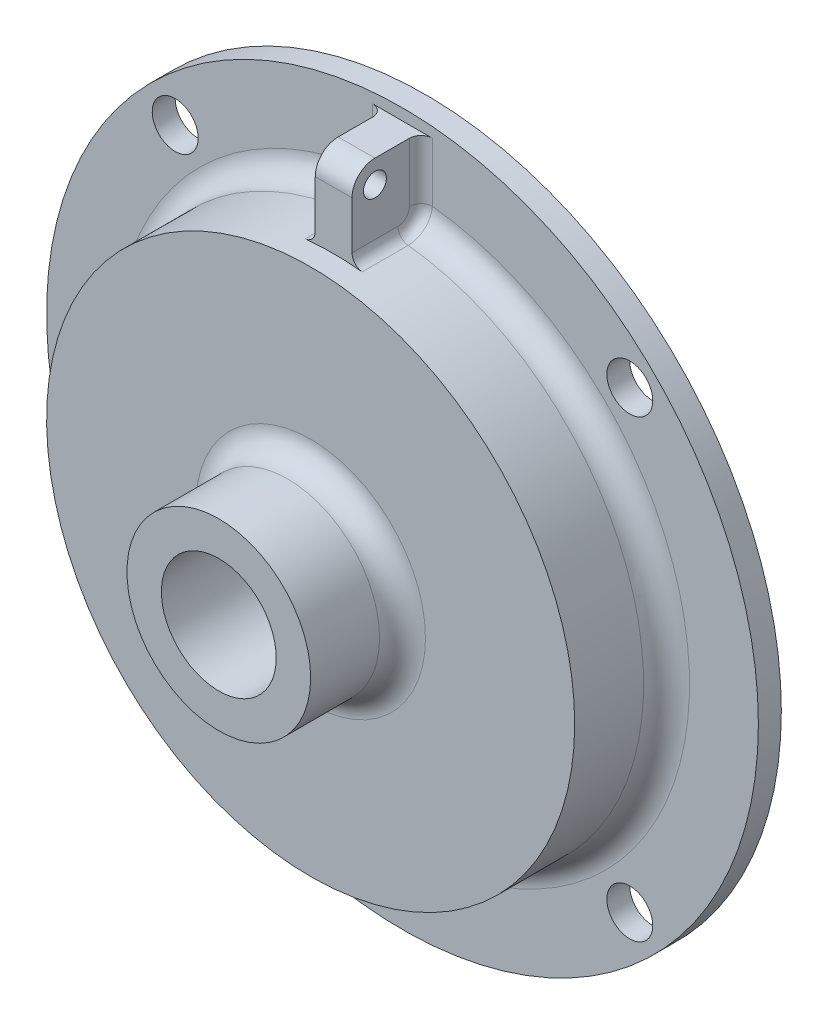
from build123d import *

# Parameters (mm, degrees)
SKETCH1_R           = 49.2125
BASE_EXTRUDE_DEPTH  = 3.175
SKETCH5_R           = 3.175
CUT_EXTRUDE2_DEPTH  = 70.669368718
CIRPATTERN1_COUNT   = 4
SKETCH2_R           = 36.5125
BOSS_EXTRUDE1_DEPTH = 12.7
SKETCH3_R           = 12.7
BOSS_EXTRUDE2_DEPTH = 12.7
FILLET1_R           = 3.175
SKETCH6_W           = 5.08
SKETCH6_H           = 9.525
BOSS_EXTRUDE3_DEPTH = 47.625
SKETCH4_R           = 7.9375
CUT_EXTRUDE1_DEPTH  = 76.23477213
FILLET2_R           = 3.175
CUT_EXTRUDE3_REACH  = 78.92
SKETCH7_R           = 1.5875
FILLET3_R           = 1.5875


with BuildPart() as part:
    # Sketch1 → Base-Extrude (new body)
    with BuildSketch(Plane.XY):
        Circle(SKETCH1_R)
    extrude(amount=BASE_EXTRUDE_DEPTH)

    # Sketch5 → Cut-Extrude2 (cut, through all)
    with BuildSketch(Plane.XY.offset(3.175)):
        with Locations((31.430896424, 31.430896424)):
            Circle(SKETCH5_R)
    cut_extrude2 = extrude(amount=-CUT_EXTRUDE2_DEPTH, mode=Mode.SUBTRACT)

    # CirPattern1: Cut-Extrude2 ×4 about axis
    cirpattern1_axis = Axis((0, 0, 0), (0, 0, 1))
    for i in range(1, CIRPATTERN1_COUNT):
        add(cut_extrude2.rotate(cirpattern1_axis, i * 360 / CIRPATTERN1_COUNT), mode=Mode.SUBTRACT)

    # Sketch2 → Boss-Extrude1 (add)
    with BuildSketch(Plane.XY.offset(3.175)):
        Circle(SKETCH2_R)
    extrude(amount=BOSS_EXTRUDE1_DEPTH)

    # Sketch3 → Boss-Extrude2 (add)
    with BuildSketch(Plane.XY.offset(15.875)):
        Circle(SKETCH3_R)
    extrude(amount=BOSS_EXTRUDE2_DEPTH)

    # Fillet1
    fillet1_edges = [part.edges().sort_by_distance(p)[0] for p in [
        (-36.5125, 0, 3.175),
        (-12.7, 0, 15.875),
    ]]
    fillet(fillet1_edges, radius=FILLET1_R)

    # Sketch6 → Boss-Extrude3 (add)
    with BuildSketch(Plane(origin=(0, 0, 0), x_dir=(1, 0, 0), z_dir=(0, 1, 0))):
        with Locations((0, -7.9375)):
            Rectangle(SKETCH6_W, SKETCH6_H)
    extrude(amount=BOSS_EXTRUDE3_DEPTH)

    # Sketch4 → Cut-Extrude1 (cut, through all)
    with BuildSketch(Plane.XY.offset(28.575)):
        Circle(SKETCH4_R)
    extrude(amount=-CUT_EXTRUDE1_DEPTH, mode=Mode.SUBTRACT)

    # Fillet2
    fillet2_edges = [part.edges().sort_by_distance(p)[0] for p in [
        (0, 47.625, 12.7),
    ]]
    fillet(fillet2_edges, radius=FILLET2_R)

    # Sketch7 → Cut-Extrude3 (cut, up to next)
    with BuildSketch(Plane(origin=(2.54, 0, 0), x_dir=(0, 0, -1), z_dir=(1, 0, 0)), mode=Mode.PRIVATE) as cut_extrude3_sk1:
        with Locations((-9.525, 44.45)):
            Circle(SKETCH7_R)
    cut_extrude3_tool1 = extrude(cut_extrude3_sk1.sketch, amount=-CUT_EXTRUDE3_REACH, mode=Mode.PRIVATE) & part.part
    add(cut_extrude3_tool1.solids().sort_by_distance((2.54, 44.45, 9.525))[0], mode=Mode.SUBTRACT)

    # Fillet3
    fillet3_edges = [part.edges().sort_by_distance(p)[0] for p in [
        (-2.54, 36.424045029, 9.5249997),
        (-2.54, 43.615568299, 3.175),
        (2.54, 43.615568299, 3.175),
        (2.54, 36.424045029, 9.5249997),
    ]]
    fillet(fillet3_edges, radius=FILLET3_R)


solid = part.part
